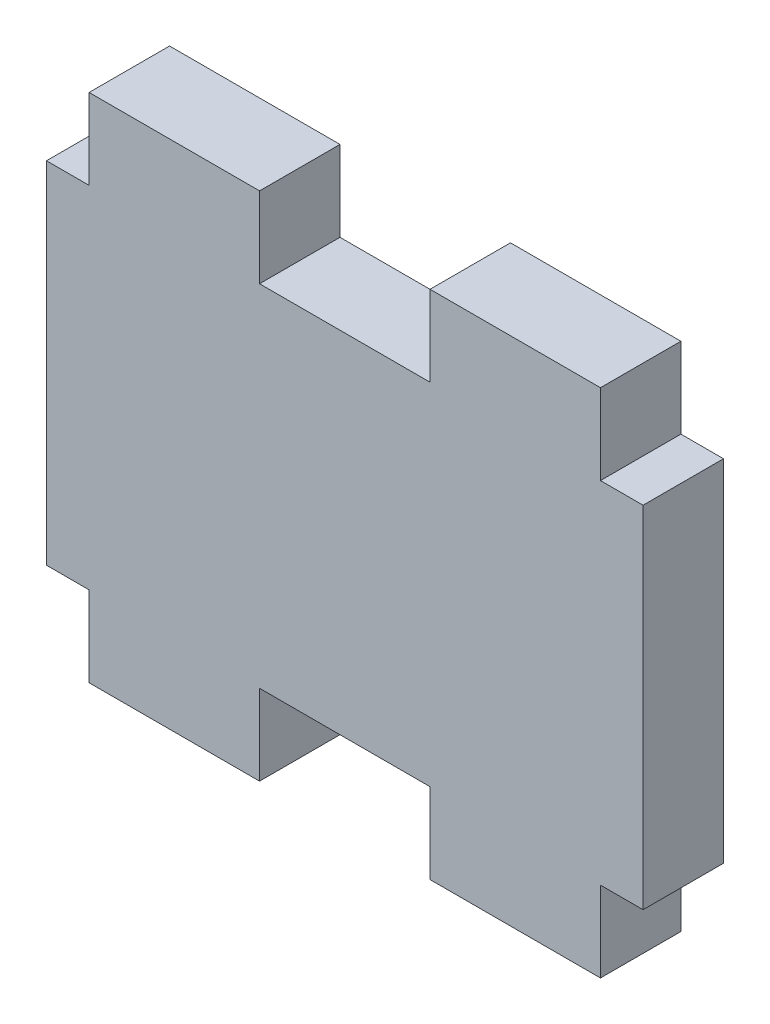
from build123d import *

# Parameters (mm, degrees)
BOSS_EXTRUDE1_DEPTH = 2.9972


with BuildPart() as part:
    # Sketch1 → Boss-Extrude1 (new body)
    with BuildSketch(Plane.XY):
        Polygon((0, 0), (1.5875, 0), (1.5875, -2.9972), (7.9375, -2.9972), (7.9375, 0), (14.2875, 0), (14.2875, -2.9972), (20.6375, -2.9972), (20.6375, 0), (22.225, 0), (22.225, 13.05052), (20.6375, 13.05052), (20.6375, 16.04772), (14.2875, 16.04772), (14.2875, 13.05052), (7.9375, 13.05052), (7.9375, 16.04772), (1.5875, 16.04772), (1.5875, 13.05052), (0, 13.05052), align=None)
    extrude(amount=BOSS_EXTRUDE1_DEPTH)


solid = part.part
